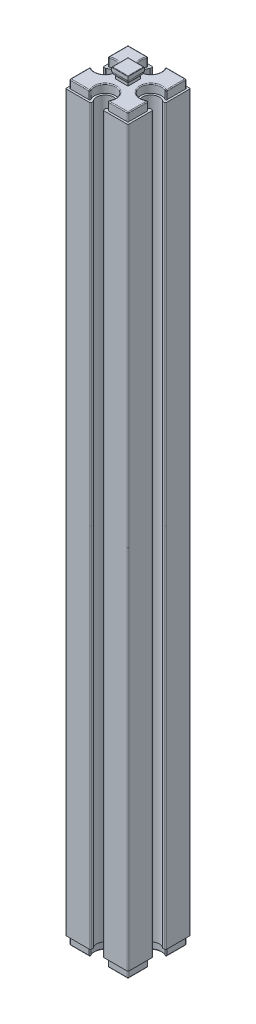
from build123d import *

# Parameters (mm, degrees)
EXTRUDE_1_DEPTH        = 88
EXTRUDE_2_DEPTH        = 2
EXTRUDE_3_DEPTH        = 2
FILLET_3_R             = 0.2
CUT_EXTRUDE_1_DEPTH    = 3
FILLET_4_R             = 0.2
FILLET_5_R             = 0.1
FILLET_3_OF_MIRROR_1_R = 0.2
FILLET_4_OF_MIRROR_1_R = 0.2
FILLET_5_OF_MIRROR_1_R = 0.1


with BuildPart() as part:
    # 草图1 → 凸台-拉伸1 (new body)
    with BuildSketch(Plane(origin=(0, 0, 0), x_dir=(1, 0, 0), z_dir=(0, 1, 0))):
        with BuildLine():
            Line((-7.5, 7.5), (-1.5, 7.5))
            Line((-1.5, 7.5), (-1.5, 6.822875656))
            ThreePointArc((-1.5, 6.822875656), (0, 3.5), (1.5, 6.822875656))
            Line((1.5, 6.822875656), (1.5, 7.5))
            Line((1.5, 7.5), (7.5, 7.5))
            Line((7.5, 7.5), (7.5, 1.5))
            Line((7.5, 1.5), (6.822875656, 1.5))
            ThreePointArc((6.822875656, 1.5), (3.5, 0), (6.822875656, -1.5))
            Line((6.822875656, -1.5), (7.5, -1.5))
            Line((7.5, -1.5), (7.5, -7.5))
            Line((7.5, -7.5), (1.5, -7.5))
            Line((1.5, -7.5), (1.5, -6.822875656))
            ThreePointArc((1.5, -6.822875656), (0, -3.5), (-1.5, -6.822875656))
            Line((-1.5, -6.822875656), (-1.5, -7.5))
            Line((-1.5, -7.5), (-7.5, -7.5))
            Line((-7.5, -7.5), (-7.5, -1.5))
            Line((-7.5, -1.5), (-6.822875656, -1.5))
            ThreePointArc((-6.822875656, -1.5), (-3.5, 0), (-6.822875656, 1.5))
            Line((-6.822875656, 1.5), (-7.5, 1.5))
            Line((-7.5, 1.5), (-7.5, 7.5))
        make_face()
    extrude_1 = extrude(amount=EXTRUDE_1_DEPTH)

    # 草图2 → 凸台-拉伸2 (add)
    with BuildSketch(Plane(origin=(0, 88, 0), x_dir=(1, 0, 0), z_dir=(0, 1, 0))):
        with BuildLine():
            Line((-7, 7), (-7, 2))
            ThreePointArc((-7, 2), (-3, 0), (-7, -2))
            Line((-7, -2), (-7, -7))
            Line((-7, -7), (-2, -7))
            ThreePointArc((-2, -7), (0, -3), (2, -7))
            Line((2, -7), (7, -7))
            Line((7, -7), (7, -2))
            ThreePointArc((7, -2), (3, 0), (7, 2))
            Line((7, 2), (7, 7))
            Line((7, 7), (2, 7))
            ThreePointArc((2, 7), (0, 3), (-2, 7))
            Line((-2, 7), (-7, 7))
        make_face()
    extrude_2 = extrude(amount=EXTRUDE_2_DEPTH)

    # 草图3 → 凸台-拉伸3 (add, symmetric)
    with BuildSketch(Plane(origin=(0, 0, 0), x_dir=(0, 0, -1), z_dir=(1, 0, 0))):
        with BuildLine():
            Line((-1.5, 90), (1.5, 90))
            Line((1.5, 90), (1.5, 90.677124344))
            ThreePointArc((1.5, 90.677124344), (1.780042303, 91.088161527), (1.95, 91.555590279))
            Line((1.95, 91.555590279), (1.95, 92.5))
            Line((1.95, 92.5), (-1.95, 92.5))
            Line((-1.95, 92.5), (-1.95, 91.555590279))
            ThreePointArc((-1.95, 91.555590279), (-1.780042303, 91.088161527), (-1.5, 90.677124344))
            Line((-1.5, 90.677124344), (-1.5, 90))
        make_face()
    extrude_3 = extrude(amount=EXTRUDE_3_DEPTH, both=True)

    # 圆角3
    fillet_3_edges = [part.edges().sort_by_distance(p)[0] for p in [
        (-7.5, 44, -7.5),
        (-1.5, 44, -7.5),
        (1.5, 44, -7.5),
        (7.5, 44, -7.5),
        (7.5, 44, -1.5),
        (7.5, 44, 1.5),
        (7.5, 44, 7.5),
        (1.5, 44, 7.5),
        (-1.5, 44, 7.5),
        (-7.5, 44, 7.5),
        (-7.5, 44, 1.5),
        (-6.822875656, 44, -1.5),
        (-7.5, 44, -1.5),
    ]]
    fillet(fillet_3_edges, radius=FILLET_3_R)

    # 草图4 → 切除-拉伸1 (cut, symmetric)
    with BuildSketch(Plane.XY):
        with BuildLine():
            Line((1.95, 92.5), (2, 92.5))
            Line((2, 92.5), (2, 90))
            Line((2, 90), (1.5, 90))
            Line((1.5, 90), (1.5, 90.677124344))
            ThreePointArc((1.5, 90.677124344), (1.780042303, 91.088161527), (1.95, 91.555590279))
            Line((1.95, 91.555590279), (1.95, 92.5))
        make_face()
        with BuildLine():
            Line((-1.95, 92.5), (-1.95, 91.555590279))
            ThreePointArc((-1.95, 91.555590279), (-1.780042303, 91.088161527), (-1.5, 90.677124344))
            Line((-1.5, 90.677124344), (-1.5, 90))
            Line((-1.5, 90), (-2, 90))
            Line((-2, 90), (-2, 92.5))
            Line((-2, 92.5), (-1.95, 92.5))
        make_face()
    cut_extrude_1 = extrude(amount=CUT_EXTRUDE_1_DEPTH, both=True, mode=Mode.SUBTRACT)

    # 圆角4
    fillet_4_edges = [part.edges().sort_by_distance(p)[0] for p in [
        (-2, 89, -7),
        (-7, 89, -7),
        (-7, 89, -2),
        (-7, 89, 2),
        (-7, 89, 7),
        (-2, 89, 7),
        (2, 89, 7),
        (7, 89, 7),
        (7, 89, 2),
        (7, 89, -2),
        (7, 89, -7),
        (2, 89, -7),
        (-4.5, 90, -7),
        (-7, 90, -4.5),
        (-3, 90, 0),
        (-7, 90, 4.5),
        (-4.5, 90, 7),
        (0, 90, 3),
        (4.5, 90, 7),
        (7, 90, 4.5),
        (3, 90, 0),
        (7, 90, -4.5),
        (4.5, 90, -7),
        (0, 90, -3),
    ]]
    fillet(fillet_4_edges, radius=FILLET_4_R)

    # 圆角5
    fillet_5_edges = [part.edges().sort_by_distance(p)[0] for p in [
        (1.95, 92.5, 0),
        (0, 92.5, -1.95),
        (0, 92.5, 1.95),
        (-1.95, 92.5, 0),
    ]]
    fillet(fillet_5_edges, radius=FILLET_5_R)


with BuildPart() as mirror_1_1:
    # 镜向1: 凸台-拉伸1, 凸台-拉伸2, 凸台-拉伸3 across Top Plane
    add(extrude_1.mirror(Plane(origin=(0, 0, 0), x_dir=(1, 0, 0), z_dir=(0, 1, 0))))
    add(extrude_2.mirror(Plane(origin=(0, 0, 0), x_dir=(1, 0, 0), z_dir=(0, 1, 0))))
    add(extrude_3.mirror(Plane(origin=(0, 0, 0), x_dir=(1, 0, 0), z_dir=(0, 1, 0))))

    # Mirror 1 2: 切除-拉伸1 across Top Plane
    add(cut_extrude_1.mirror(Plane(origin=(0, 0, 0), x_dir=(1, 0, 0), z_dir=(0, 1, 0))), mode=Mode.SUBTRACT)

    # 圆角3 of 镜向1
    fillet_3_of_mirror_1_edges = [mirror_1_1.edges().sort_by_distance(p)[0] for p in [
        (-7.5, -44, -7.5),
        (-1.5, -44, -7.5),
        (1.5, -44, -7.5),
        (7.5, -44, -7.5),
        (7.5, -44, -1.5),
        (7.5, -44, 1.5),
        (7.5, -44, 7.5),
        (1.5, -44, 7.5),
        (-1.5, -44, 7.5),
        (-7.5, -44, 7.5),
        (-7.5, -44, 1.5),
        (-6.822875656, -44, -1.5),
        (-7.5, -44, -1.5),
    ]]
    fillet(fillet_3_of_mirror_1_edges, radius=FILLET_3_OF_MIRROR_1_R)

    # 圆角4 of 镜向1
    fillet_4_of_mirror_1_edges = [mirror_1_1.edges().sort_by_distance(p)[0] for p in [
        (-2, -89, -7),
        (-7, -89, -7),
        (-7, -89, -2),
        (-7, -89, 2),
        (-7, -89, 7),
        (-2, -89, 7),
        (2, -89, 7),
        (7, -89, 7),
        (7, -89, 2),
        (7, -89, -2),
        (7, -89, -7),
        (2, -89, -7),
        (-4.5, -90, -7),
        (-7, -90, -4.5),
        (-3, -90, 0),
        (-7, -90, 4.5),
        (-4.5, -90, 7),
        (0, -90, 3),
        (4.5, -90, 7),
        (7, -90, 4.5),
        (3, -90, 0),
        (7, -90, -4.5),
        (4.5, -90, -7),
        (0, -90, -3),
    ]]
    fillet(fillet_4_of_mirror_1_edges, radius=FILLET_4_OF_MIRROR_1_R)

    # 圆角5 of 镜向1
    fillet_5_of_mirror_1_edges = [mirror_1_1.edges().sort_by_distance(p)[0] for p in [
        (1.95, -92.5, 0),
        (0, -92.5, -1.95),
        (0, -92.5, 1.95),
        (-1.95, -92.5, 0),
    ]]
    fillet(fillet_5_of_mirror_1_edges, radius=FILLET_5_OF_MIRROR_1_R)


with BuildPart() as part_1:
    add(part.part)

    # 镜向1 united with what the copies tou: union 镜向1_1
    add(mirror_1_1.part)


solid = part_1.part
